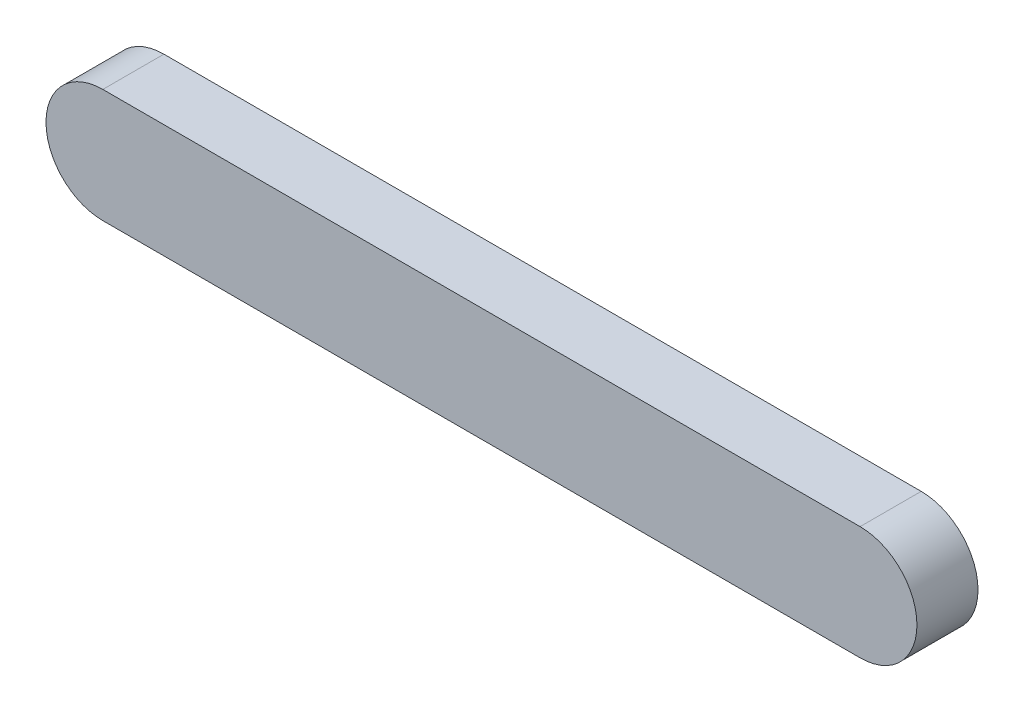
from build123d import *

# Parameters (mm, degrees)
BOSS_EXTRUDE1_DEPTH = 10


with BuildPart() as part:
    # Sketch1 → Boss-Extrude1 (new body)
    with BuildSketch(Plane.XY):
        with BuildLine():
            Line((69.466063161, -9.305393984), (-54.533936839, -9.305393984))
            ThreePointArc((-54.533936839, -9.305393984), (-63.839330824, 0), (-54.533936839, 9.305393984))
            Line((-54.533936839, 9.305393984), (69.466063161, 9.305393984))
            ThreePointArc((69.466063161, 9.305393984), (78.771457145, 0), (69.466063161, -9.305393984))
        make_face()
    extrude(amount=BOSS_EXTRUDE1_DEPTH)


solid = part.part
